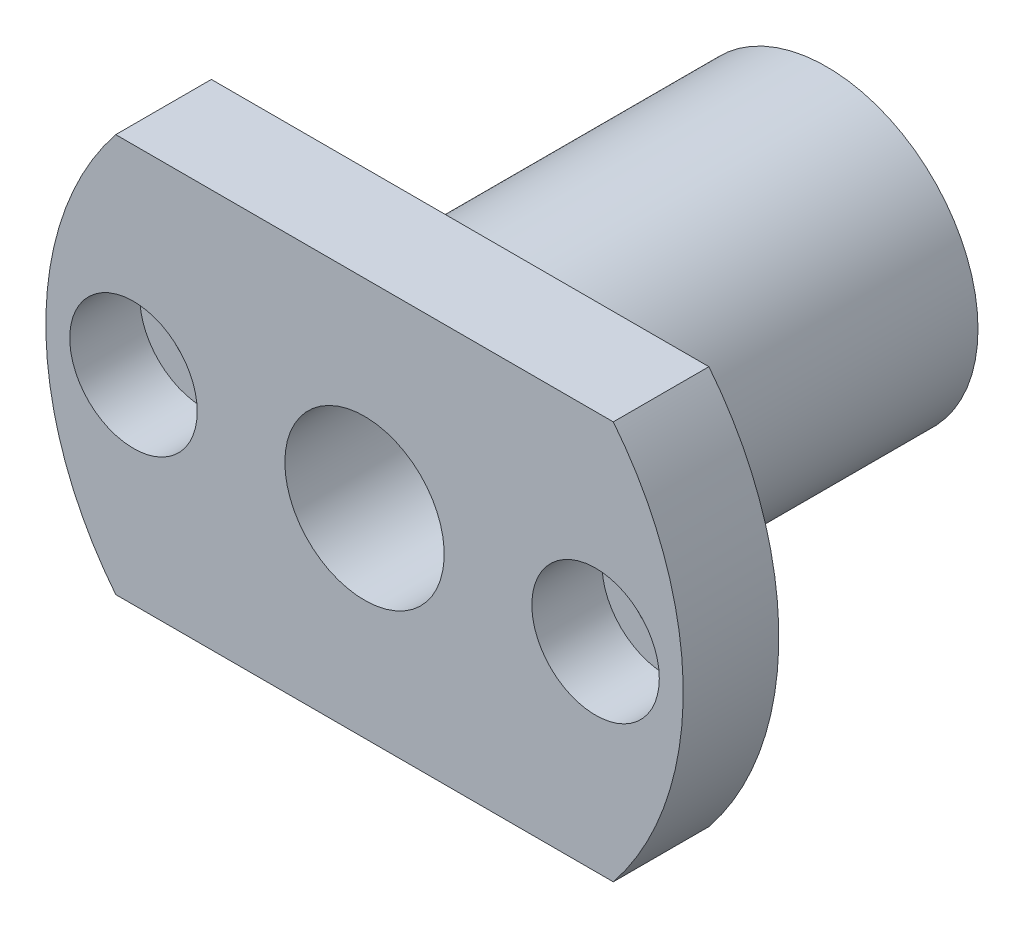
from build123d import *

# Parameters (mm, degrees)
SKETCH_2_OUTSIDE_W        = 54.714
SKETCH_2_OUTSIDE_H        = 54.714
SKETCH_2_OUTSIDE_W_2      = 40
SKETCH_2_OUTSIDE_H_2      = 25
CUT_EXTRUDE_1_DEPTH       = 6
HOLE_WIZARD_1_D           = 4.5
HOLE_WIZARD_1_CBORE_D     = 8
HOLE_WIZARD_1_CBORE_DEPTH = 4.4


with BuildPart() as part:
    # 草图1 → 旋转1 (revolve)
    with BuildSketch(Plane(origin=(0, 0, 0), x_dir=(0, 0, 1), z_dir=(0, -1, 0))):
        Polygon((0, 5), (29, 5), (29, 20), (23, 20), (23, 9.5), (0, 9.5), align=None)
    revolve(axis=Axis((0, 0, 0), (0, 0, 1)))

    # 草图2 outside → 切除-拉伸1 (cut)
    with BuildSketch(Plane.XY.offset(29)):
        Rectangle(SKETCH_2_OUTSIDE_W, SKETCH_2_OUTSIDE_H)
        Rectangle(SKETCH_2_OUTSIDE_W_2, SKETCH_2_OUTSIDE_H_2, mode=Mode.SUBTRACT)
    extrude(amount=-CUT_EXTRUDE_1_DEPTH, mode=Mode.SUBTRACT)

    # 孔1 (through all)
    with Locations(Plane.XY.offset(29)):
        with Locations((-14.5, 0), (14.5, 0)):
            CounterBoreHole(HOLE_WIZARD_1_D / 2, HOLE_WIZARD_1_CBORE_D / 2, HOLE_WIZARD_1_CBORE_DEPTH)


solid = part.part
